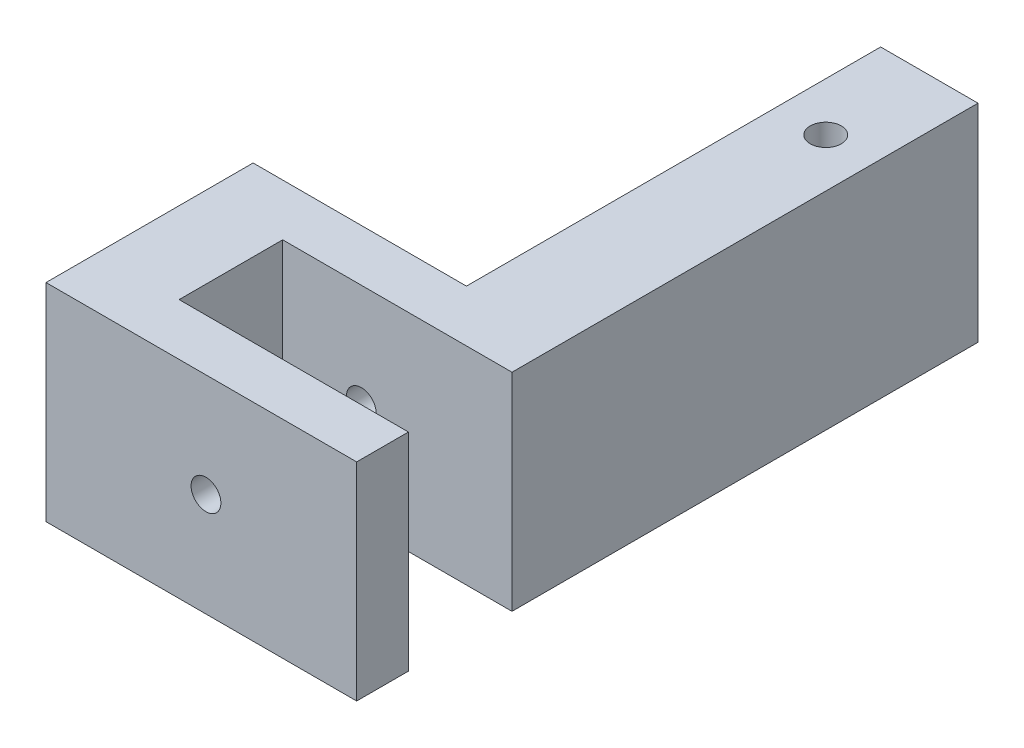
from build123d import *

# Parameters (mm, degrees)
SKETCH1_R                                      = 1.905
BOSS_EXTRUDE2_DEPTH                            = 25.4
CSK_FOR_6_OVAL_HEAD_MACHINE_SCREW1_D           = 3.6576
CSK_FOR_6_OVAL_HEAD_MACHINE_SCREW1_CSINK_D     = 7.0866
CSK_FOR_6_OVAL_HEAD_MACHINE_SCREW1_CSINK_ANGLE = 82


with BuildPart() as part:
    # Sketch1 → Boss-Extrude2 (new body)
    with BuildSketch(Plane(origin=(0, 0, 0), x_dir=(1, 0, 0), z_dir=(0, 1, 0))):
        Polygon((0, 0), (-28.124290221, 0), (-28.124290221, 12.7), (0, 12.7), (0, 19.05), (0, 69.85), (-11.938801262, 69.85), (-11.938801262, 19.05), (-38.1, 19.05), (-38.1, 7.031072555), (-38.1, -6.35), (0, -6.35), align=None)
        with Locations(Location((-5.969400631, 57.15, 0), (0, 0, 270))):
            Circle(SKETCH1_R, mode=Mode.SUBTRACT)
    extrude(amount=BOSS_EXTRUDE2_DEPTH)

    # CSK for #6 Oval Head Machine Screw1 (through all)
    with Locations(Plane(origin=(0, 0, -19.05), x_dir=(-1, 0, 0), z_dir=(0, 0, -1))):
        with Locations((18.479100946, 12.7)):
            CounterSinkHole(CSK_FOR_6_OVAL_HEAD_MACHINE_SCREW1_D / 2, CSK_FOR_6_OVAL_HEAD_MACHINE_SCREW1_CSINK_D / 2, counter_sink_angle=CSK_FOR_6_OVAL_HEAD_MACHINE_SCREW1_CSINK_ANGLE)


solid = part.part
